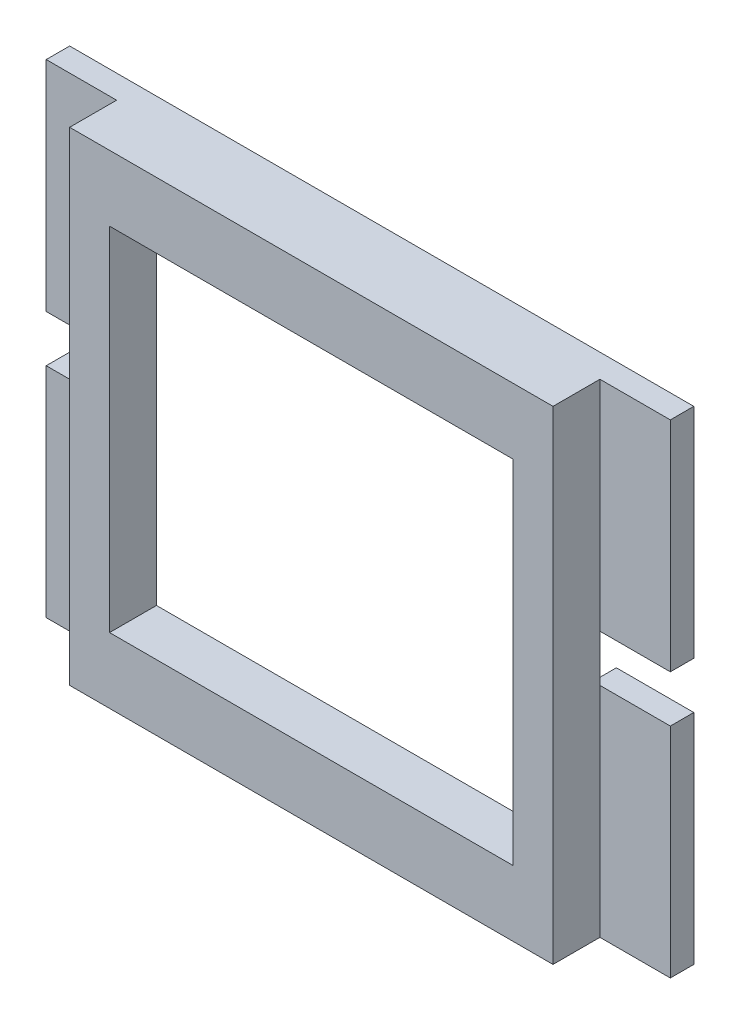
from build123d import *

# Parameters (mm, degrees)
SKETCH1_W           = 103
SKETCH1_H           = 103
BOSS_EXTRUDE1_DEPTH = 15
SKETCH3_W           = 15
SKETCH3_H           = 103
BOSS_EXTRUDE2_DEPTH = 5
CUT_EXTRUDE1_DEPTH  = 5
SKETCH5_W           = 86
SKETCH5_H           = 75
CUT_EXTRUDE2_DEPTH  = 157.949036314
CUT_EXTRUDE5_REACH  = 170.888
SKETCH9_W           = 10
SKETCH9_H           = 10


with BuildPart() as part:
    # Sketch1 → Boss-Extrude1 (new body)
    with BuildSketch(Plane.XY):
        with Locations((51.5, -51.5)):
            Rectangle(SKETCH1_W, SKETCH1_H)
    extrude(amount=BOSS_EXTRUDE1_DEPTH)

    # Sketch3 → Boss-Extrude2 (add)
    with BuildSketch(Plane(origin=(0, 0, 0), x_dir=(-1, 0, 0), z_dir=(0, 0, -1))):
        with Locations((7.5, -51.5)):
            Rectangle(SKETCH3_W, SKETCH3_H)
        with Locations((-110.5, -51.5)):
            Rectangle(SKETCH3_W, SKETCH3_H)
    extrude(amount=-BOSS_EXTRUDE2_DEPTH)

    # Sketch4 → Cut-Extrude1 (cut)
    with BuildSketch(Plane(origin=(0, 0, 0), x_dir=(-1, 0, 0), z_dir=(0, 0, -1))):
        Polygon((-51.5, -51.5), (-101.5, -1.5), (-101.5, -101.5), align=None)
        Polygon((-1.5, -1.5), (-101.5, -1.5), (-51.5, -51.5), align=None)
        Polygon((-1.5, -1.5), (-51.5, -51.5), (-1.5, -101.5), align=None)
        Polygon((-1.5, -101.5), (-51.5, -51.5), (-101.5, -101.5), align=None)
    extrude(amount=-CUT_EXTRUDE1_DEPTH, mode=Mode.SUBTRACT)

    # Sketch5 → Cut-Extrude2 (cut, through all)
    with BuildSketch(Plane(origin=(0, 0, 5), x_dir=(-1, 0, 0), z_dir=(0, 0, -1))):
        with Locations((-51.5, -51.5)):
            Rectangle(SKETCH5_W, SKETCH5_H)
    extrude(amount=-CUT_EXTRUDE2_DEPTH, mode=Mode.SUBTRACT)

    # Cut-Extrude5: up to this face of the body (flat: up to its plane)
    cut_extrude5_end = Plane(part.part.faces().sort_by_distance((8.5, -51.5, 10))[0])
    # Sketch9 → Cut-Extrude5 (cut, up to the picked face)
    with BuildSketch(Plane.ZY.offset(15), mode=Mode.PRIVATE) as cut_extrude5_sk1:
        with Locations((0, -51.5)):
            Rectangle(SKETCH9_W, SKETCH9_H)
    cut_extrude5_tool1 = split(extrude(cut_extrude5_sk1.sketch, amount=-CUT_EXTRUDE5_REACH, mode=Mode.PRIVATE), bisect_by=cut_extrude5_end, keep=Keep.BOTH, mode=Mode.PRIVATE)
    cut_extrude5 = cut_extrude5_tool1.solids().sort_by(Axis((-15, -51.5, 0), (1, 0, 0)))[0]
    add(cut_extrude5, mode=Mode.SUBTRACT)

    # Mirror1: Cut-Extrude5 across plane
    add(cut_extrude5.mirror(Plane.ZY.offset(-51.5)), mode=Mode.SUBTRACT)


solid = part.part
